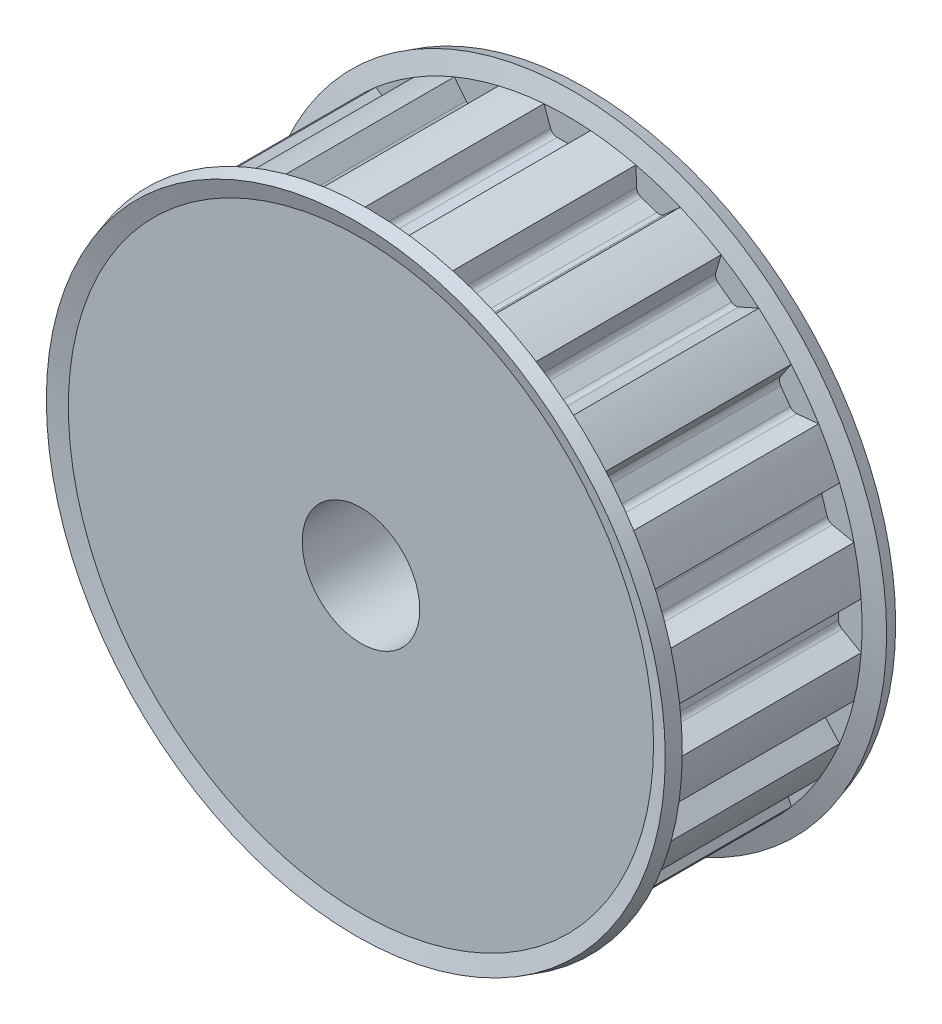
from build123d import *

# Parameters (mm, degrees)
SKETCH1_R           = 15.9131
BASEPULLEY_DEPTH    = 10.414
GROOVE_DEPTH        = 5.207
GROOVES_COUNT       = 20
GROOVES_ANGLE       = 342
SKETCH4_W           = 0.254
SKETCH4_H           = 11.43
BORSKE_R            = 3.175
BORE_DEPTH          = 27.855010035
SKETCH7_R           = 16.713739002
SKETCH7_R_2         = 3.214245881
BOSS_EXTRUDE1_DEPTH = 0.254


with BuildPart() as part:
    # Sketch1 → BasePulley (new body)
    with BuildSketch(Plane.XY):
        Circle(SKETCH1_R)
    extrude(amount=-BASEPULLEY_DEPTH)

    # Sketch2 → Flange (revolve)
    with BuildSketch(Plane(origin=(0, 0, 0), x_dir=(0, 0, -1), z_dir=(1, 0, 0)), mode=Mode.PRIVATE) as flange_sk:
        Polygon((10.414, 15.9131), (10.724622372, 16.9291), (11.429036456, 16.713739002), (11.1506, 15.803014392), (11.1506, 0), (-0.7366, 0), (-0.7366, 15.803014392), (-1.015036456, 16.713739002), (-0.310622372, 16.9291), (0, 15.9131), align=None)
    revolve(flange_sk.sketch.rotate(Axis((0, 0, 0), (0, 0, -1)), 90), axis=Axis((0, 0, 0), (0, 0, -1)))

    # Sketch3 → Groove (cut, symmetric)
    with BuildSketch(Plane.XY.offset(-5.207)):
        with BuildLine():
            Line((-1.2827, 15.9131), (-1.2827, 41.3131))
            Line((-1.2827, 41.3131), (1.2827, 41.3131))
            Line((1.2827, 41.3131), (1.2827, 15.9131))
            Line((1.2827, 15.9131), (0.659450384, 14.8336))
            ThreePointArc((0.659450384, 14.8336), (0.519994706, 14.694144321), (0.329494706, 14.6431))
            Line((0.329494706, 14.6431), (-0.55367873, 14.6431))
            ThreePointArc((-0.55367873, 14.6431), (-0.772211353, 14.712003071), (-0.911701619, 14.893790325))
            Line((-0.911701619, 14.893790325), (-1.2827, 15.9131))
        make_face()
    groove = extrude(amount=GROOVE_DEPTH, both=True, mode=Mode.SUBTRACT)

    # Grooves: Groove ×20 about axis
    grooves_axis = Axis((0, 0, -10.414), (0, 0, 1))
    for i in range(1, GROOVES_COUNT):
        add(groove.rotate(grooves_axis, i * GROOVES_ANGLE / (GROOVES_COUNT - 1)), mode=Mode.SUBTRACT)

    # Sketch4 → BaseHub (revolve)
    with BuildSketch(Plane(origin=(0, 0, 0), x_dir=(0, 0, -1), z_dir=(1, 0, 0)), mode=Mode.PRIVATE) as basehub_sk:
        with Locations((-0.127, 5.715)):
            Rectangle(SKETCH4_W, SKETCH4_H)
    revolve(basehub_sk.sketch.rotate(Axis((0, 0, 0), (0, 0, -1)), 274.520210968), axis=Axis((0, 0, 0), (0, 0, -1)))

    # BorSke → Bore (cut, through all)
    with BuildSketch(Plane.XY.offset(0.7366)):
        Circle(BORSKE_R)
    extrude(amount=-BORE_DEPTH, mode=Mode.SUBTRACT)

    # Sketch7 → Boss-Extrude1 (add)
    with BuildSketch(Plane(origin=(0, 0, -11.1506), x_dir=(-1, 0, 0), z_dir=(0, 0, -1))):
        Circle(SKETCH7_R)
        Circle(SKETCH7_R_2, mode=Mode.SUBTRACT)
    extrude(amount=BOSS_EXTRUDE1_DEPTH)


solid = part.part
